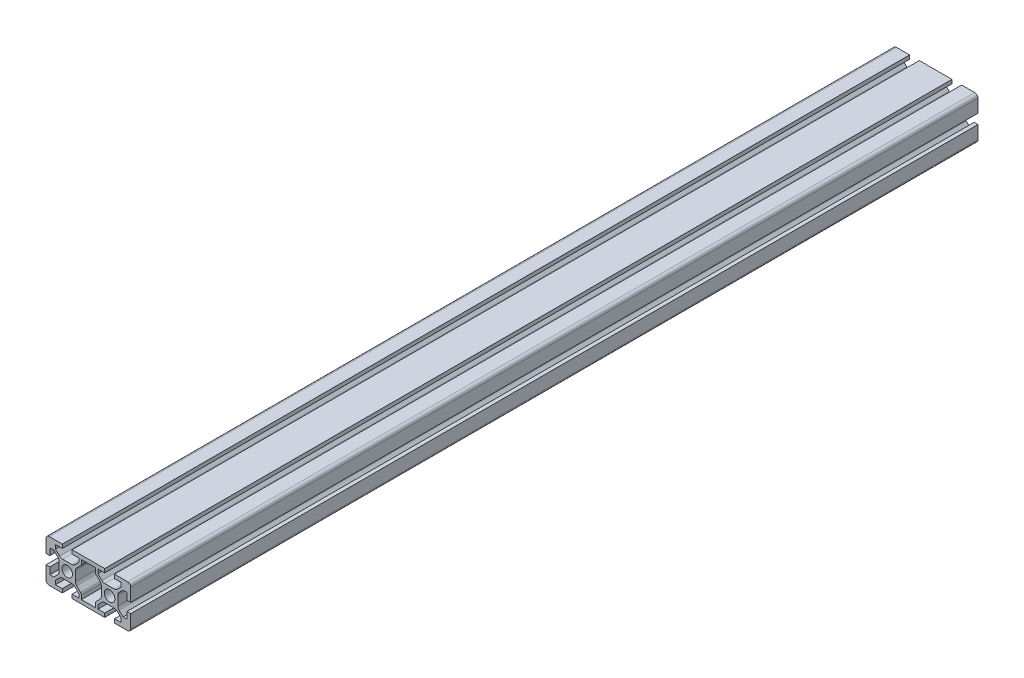
from build123d import *

# Parameters (mm, degrees)
SALIENTE_EXTRUIR1_DEPTH = 200


with BuildPart() as part:
    # Croquis1 → Saliente-Extruir1 (new, symmetric)
    with BuildSketch(Plane.XY):
        with BuildLine():
            Line((-10, 8.5), (-10, 2.3))
            Line((-10, 2.3), (-8.2, 2.3))
            Line((-8.2, 2.3), (-8.2, 5.5))
            Line((-8.2, 5.5), (-6.348528137, 5.5))
            Line((-6.348528137, 5.5), (-4.485786438, 3.6372583))
            ThreePointArc((-4.485786438, 3.6372583), (-4.052240935, 2.988411603), (-3.9, 2.223044738))
            Line((-3.9, 2.223044738), (-3.9, 0))
            Line((-3.9, 0), (-3.9, -2.223044738))
            ThreePointArc((-3.9, -2.223044738), (-4.052240935, -2.988411603), (-4.485786438, -3.6372583))
            Line((-4.485786438, -3.6372583), (-6.348528137, -5.5))
            Line((-6.348528137, -5.5), (-8.2, -5.5))
            Line((-8.2, -5.5), (-8.2, -2.3))
            Line((-8.2, -2.3), (-10, -2.3))
            Line((-10, -2.3), (-10, -8.5))
            ThreePointArc((-10, -8.5), (-9.560660172, -9.560660172), (-8.5, -10))
            Line((-8.5, -10), (-2.3, -10))
            Line((-2.3, -10), (-2.3, -8.2))
            Line((-2.3, -8.2), (-5.5, -8.2))
            Line((-5.5, -8.2), (-5.5, -6.348528137))
            Line((-5.5, -6.348528137), (-3.6372583, -4.485786438))
            ThreePointArc((-3.6372583, -4.485786438), (-2.988411603, -4.052240935), (-2.223044738, -3.9))
            Line((-2.223044738, -3.9), (0, -3.9))
            Line((0, -3.9), (2.223044738, -3.9))
            ThreePointArc((2.223044738, -3.9), (2.988411603, -4.052240935), (3.6372583, -4.485786438))
            Line((3.6372583, -4.485786438), (5.5, -6.348528137))
            Line((5.5, -6.348528137), (5.5, -8.2))
            Line((5.5, -8.2), (2.3, -8.2))
            Line((2.3, -8.2), (2.3, -10))
            Line((2.3, -10), (17.7, -10))
            Line((17.7, -10), (17.7, -8.2))
            Line((17.7, -8.2), (14.5, -8.2))
            Line((14.5, -8.2), (14.5, -6.348528137))
            Line((14.5, -6.348528137), (16.3627417, -4.485786438))
            ThreePointArc((16.3627417, -4.485786438), (17.011588397, -4.052240935), (17.776955262, -3.9))
            Line((17.776955262, -3.9), (20, -3.9))
            Line((20, -3.9), (22.223044738, -3.9))
            ThreePointArc((22.223044738, -3.9), (22.988411603, -4.052240935), (23.6372583, -4.485786438))
            Line((23.6372583, -4.485786438), (25.5, -6.348528137))
            Line((25.5, -6.348528137), (25.5, -8.2))
            Line((25.5, -8.2), (22.3, -8.2))
            Line((22.3, -8.2), (22.3, -10))
            Line((22.3, -10), (28.5, -10))
            ThreePointArc((28.5, -10), (29.560660172, -9.560660172), (30, -8.5))
            Line((30, -8.5), (30, -2.3))
            Line((30, -2.3), (28.2, -2.3))
            Line((28.2, -2.3), (28.2, -5.5))
            Line((28.2, -5.5), (26.348528137, -5.5))
            Line((26.348528137, -5.5), (24.485786438, -3.6372583))
            ThreePointArc((24.485786438, -3.6372583), (24.052240935, -2.988411603), (23.9, -2.223044738))
            Line((23.9, -2.223044738), (23.9, 0))
            Line((23.9, 0), (23.9, 2.223044738))
            ThreePointArc((23.9, 2.223044738), (24.052240935, 2.988411603), (24.485786438, 3.6372583))
            Line((24.485786438, 3.6372583), (26.348528137, 5.5))
            Line((26.348528137, 5.5), (28.2, 5.5))
            Line((28.2, 5.5), (28.2, 2.3))
            Line((28.2, 2.3), (30, 2.3))
            Line((30, 2.3), (30, 8.5))
            ThreePointArc((30, 8.5), (29.560660172, 9.560660172), (28.5, 10))
            Line((28.5, 10), (22.3, 10))
            Line((22.3, 10), (22.3, 8.2))
            Line((22.3, 8.2), (25.5, 8.2))
            Line((25.5, 8.2), (25.5, 6.348528137))
            Line((25.5, 6.348528137), (23.6372583, 4.485786438))
            ThreePointArc((23.6372583, 4.485786438), (22.988411603, 4.052240935), (22.223044738, 3.9))
            Line((22.223044738, 3.9), (20, 3.9))
            Line((20, 3.9), (17.776955262, 3.9))
            ThreePointArc((17.776955262, 3.9), (17.011588397, 4.052240935), (16.3627417, 4.485786438))
            Line((16.3627417, 4.485786438), (14.5, 6.348528137))
            Line((14.5, 6.348528137), (14.5, 8.2))
            Line((14.5, 8.2), (17.7, 8.2))
            Line((17.7, 8.2), (17.7, 10))
            Line((17.7, 10), (2.3, 10))
            Line((2.3, 10), (2.3, 8.2))
            Line((2.3, 8.2), (5.5, 8.2))
            Line((5.5, 8.2), (5.5, 6.348528137))
            Line((5.5, 6.348528137), (3.6372583, 4.485786438))
            ThreePointArc((3.6372583, 4.485786438), (2.988411603, 4.052240935), (2.223044738, 3.9))
            Line((2.223044738, 3.9), (0, 3.9))
            Line((0, 3.9), (-2.223044738, 3.9))
            ThreePointArc((-2.223044738, 3.9), (-2.988411603, 4.052240935), (-3.6372583, 4.485786438))
            Line((-3.6372583, 4.485786438), (-5.5, 6.348528137))
            Line((-5.5, 6.348528137), (-5.5, 8.2))
            Line((-5.5, 8.2), (-2.3, 8.2))
            Line((-2.3, 8.2), (-2.3, 10))
            Line((-2.3, 10), (-8.5, 10))
            ThreePointArc((-8.5, 10), (-9.560660172, 9.560660172), (-10, 8.5))
        make_face()
        with BuildLine():
            Line((3.9, 2.223044738), (3.9, 0))
            Line((3.9, 0), (3.9, -2.223044738))
            ThreePointArc((3.9, -2.223044738), (4.052240935, -2.988411603), (4.485786438, -3.6372583))
            Line((4.485786438, -3.6372583), (6.333883476, -5.485355339))
            ThreePointArc((6.333883476, -5.485355339), (6.604849416, -5.890884525), (6.7, -6.369238816))
            Line((6.7, -6.369238816), (6.7, -8.2))
            Line((6.7, -8.2), (13.3, -8.2))
            Line((13.3, -8.2), (13.3, -6.369238816))
            ThreePointArc((13.3, -6.369238816), (13.395150584, -5.890884525), (13.666116524, -5.485355339))
            Line((13.666116524, -5.485355339), (15.514213562, -3.6372583))
            ThreePointArc((15.514213562, -3.6372583), (15.947759065, -2.988411603), (16.1, -2.223044738))
            Line((16.1, -2.223044738), (16.1, 0))
            Line((16.1, 0), (16.1, 2.223044738))
            ThreePointArc((16.1, 2.223044738), (15.947759065, 2.988411603), (15.514213562, 3.6372583))
            Line((15.514213562, 3.6372583), (13.666116524, 5.485355339))
            ThreePointArc((13.666116524, 5.485355339), (13.395150584, 5.890884525), (13.3, 6.369238816))
            Line((13.3, 6.369238816), (13.3, 8.2))
            Line((13.3, 8.2), (6.7, 8.2))
            Line((6.7, 8.2), (6.7, 6.369238816))
            ThreePointArc((6.7, 6.369238816), (6.604849416, 5.890884525), (6.333883476, 5.485355339))
            Line((6.333883476, 5.485355339), (4.485786438, 3.6372583))
            ThreePointArc((4.485786438, 3.6372583), (4.052240935, 2.988411603), (3.9, 2.223044738))
        make_face(mode=Mode.SUBTRACT)
        with BuildLine():
            ThreePointArc((0, 2.5), (-1.767766953, 1.767766953), (-2.5, 0))
            ThreePointArc((-2.5, 0), (-1.767766953, -1.767766953), (0, -2.5))
            ThreePointArc((0, -2.5), (1.767766953, -1.767766953), (2.5, 0))
            ThreePointArc((2.5, 0), (1.767766953, 1.767766953), (0, 2.5))
        make_face(mode=Mode.SUBTRACT)
        with BuildLine():
            ThreePointArc((20, 2.5), (18.232233047, 1.767766953), (17.5, 0))
            ThreePointArc((17.5, 0), (18.232233047, -1.767766953), (20, -2.5))
            ThreePointArc((20, -2.5), (21.767766953, -1.767766953), (22.5, 0))
            ThreePointArc((22.5, 0), (21.767766953, 1.767766953), (20, 2.5))
        make_face(mode=Mode.SUBTRACT)
    extrude(amount=SALIENTE_EXTRUIR1_DEPTH, both=True)


solid = part.part
